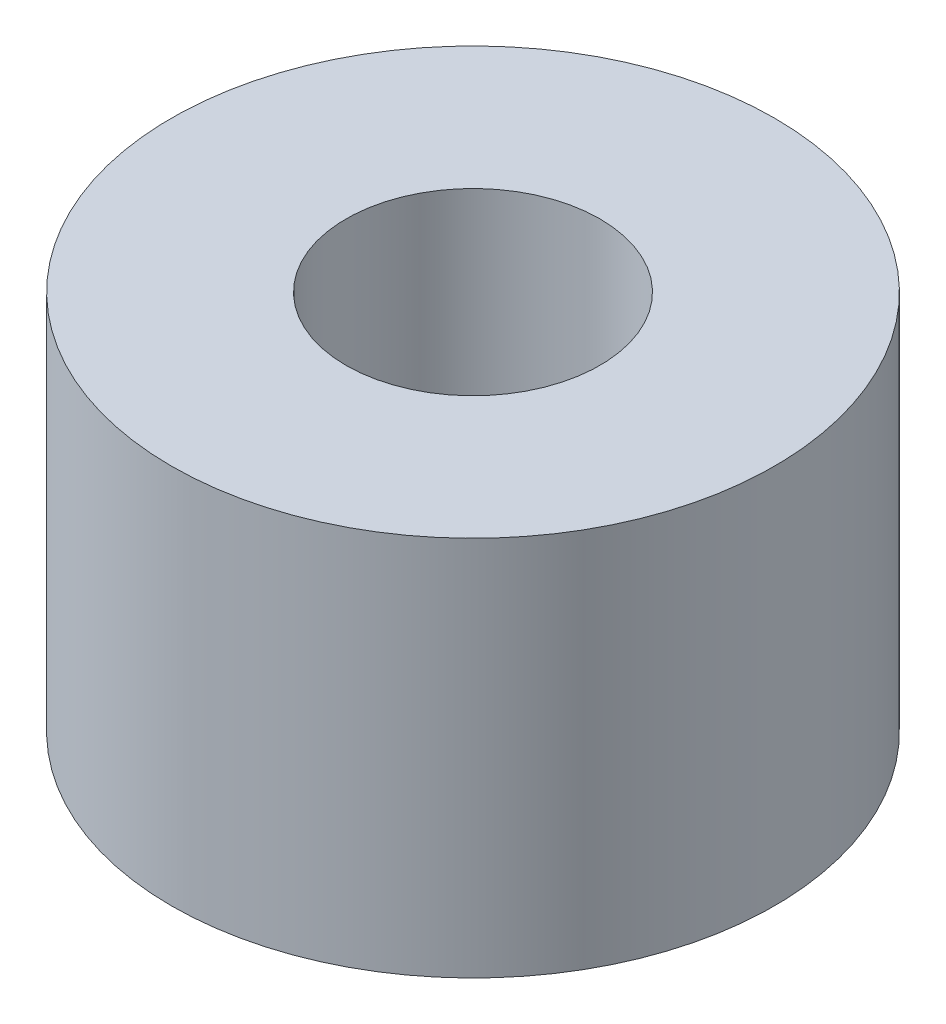
from build123d import *

# Parameters (mm, degrees)
CROQUIS1_R              = 9.5
CROQUIS1_R_2            = 4
SALIENTE_EXTRUIR1_DEPTH = 12


with BuildPart() as part:
    # Croquis1 → Saliente-Extruir1 (new body)
    with BuildSketch(Plane(origin=(0, 0, 0), x_dir=(1, 0, 0), z_dir=(0, 1, 0))):
        with Locations(Location((0, 0, 0), (0, 0, 270))):
            Circle(CROQUIS1_R)
        with Locations(Location((0, 0, 0), (0, 0, 270))):
            Circle(CROQUIS1_R_2, mode=Mode.SUBTRACT)
    extrude(amount=SALIENTE_EXTRUIR1_DEPTH)


solid = part.part
